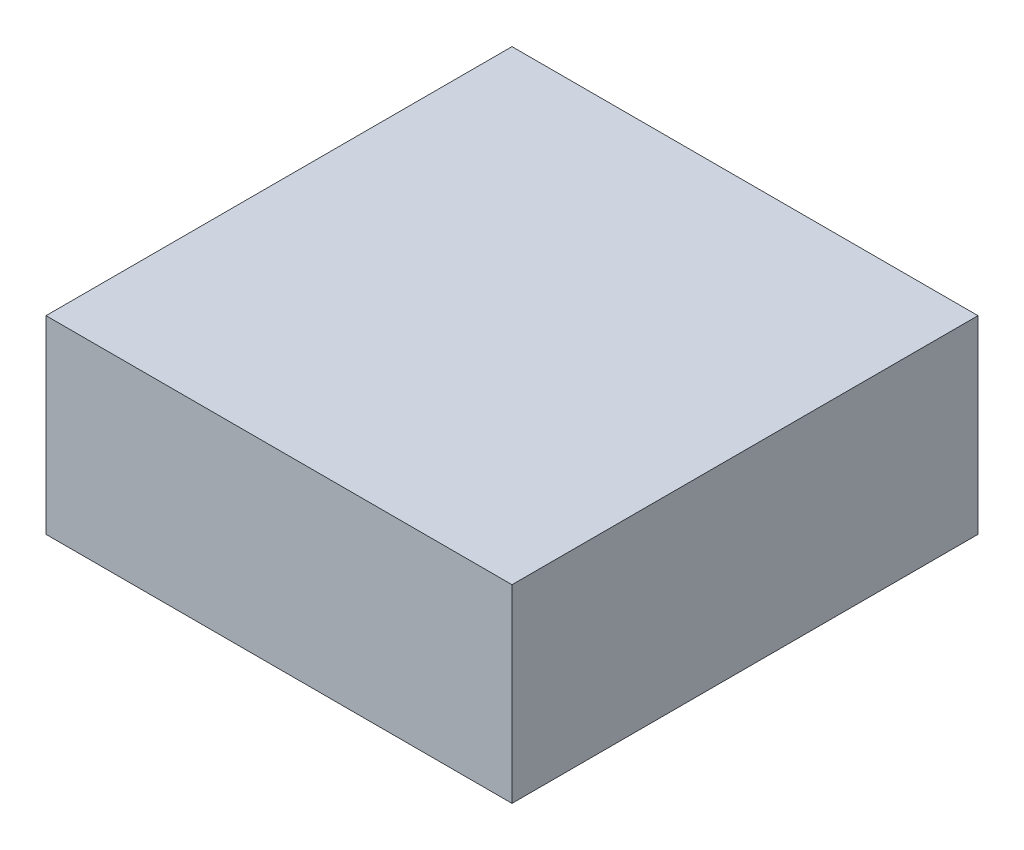
from build123d import *

# Parameters (mm, degrees)
SKETCH1_W           = 15.5
SKETCH1_H           = 15.5
BOSS_EXTRUDE1_DEPTH = 6.3


with BuildPart() as part:
    # Sketch1 → Boss-Extrude1 (new body)
    with BuildSketch(Plane(origin=(0, 0, 0), x_dir=(1, 0, 0), z_dir=(0, 1, 0))):
        Rectangle(SKETCH1_W, SKETCH1_H)
    extrude(amount=BOSS_EXTRUDE1_DEPTH)


solid = part.part
